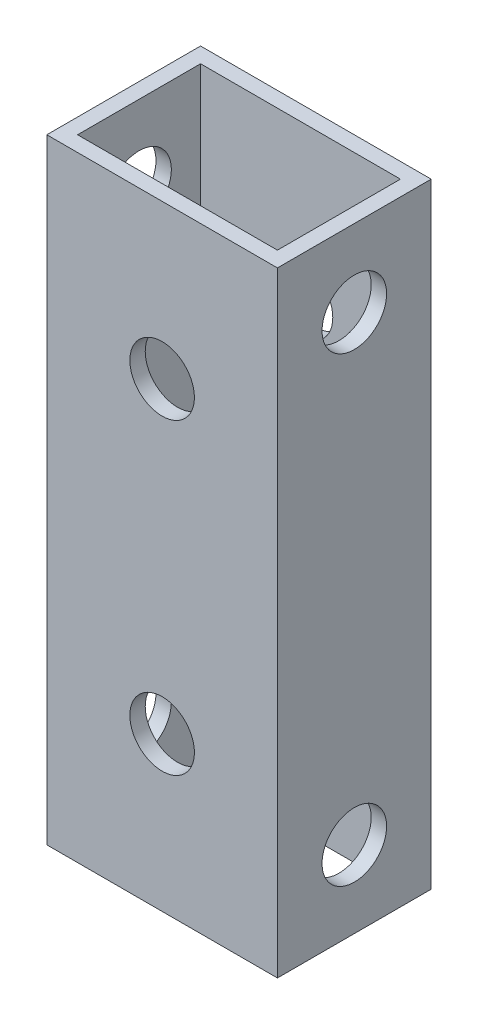
from build123d import *

# Parameters (mm, degrees)
SKETCH_1_W          = 15
SKETCH_1_H          = 10
SKETCH_1_W_2        = 13
SKETCH_1_H_2        = 8
EXTRUDE_1_DEPTH     = 40
SKETCH_2_R          = 2.1
CUT_EXTRUDE_1_DEPTH = 44.011626335
SKETCH_3_R          = 2.1
CUT_EXTRUDE_2_DEPTH = 42.907636536


with BuildPart() as part:
    # ｽｹｯﾁ1 → 押し出し-薄板1 (new body)
    with BuildSketch(Plane(origin=(0, 0, 0), x_dir=(1, 0, 0), z_dir=(0, 1, 0))):
        Rectangle(SKETCH_1_W, SKETCH_1_H)
        Rectangle(SKETCH_1_W_2, SKETCH_1_H_2, mode=Mode.SUBTRACT)
    extrude(amount=EXTRUDE_1_DEPTH)

    # ｽｹｯﾁ2 → ｶｯﾄ - 押し出し1 (cut, through all)
    with BuildSketch(Plane(origin=(7.5, 0, 0), x_dir=(0, 0, -1), z_dir=(1, 0, 0))):
        with Locations((0, 35)):
            Circle(SKETCH_2_R)
        with Locations((0, 5)):
            Circle(SKETCH_2_R)
    extrude(amount=-CUT_EXTRUDE_1_DEPTH, mode=Mode.SUBTRACT)

    # ｽｹｯﾁ3 → ｶｯﾄ - 押し出し2 (cut, through all)
    with BuildSketch(Plane.XY.offset(5)):
        with Locations((0, 30)):
            Circle(SKETCH_3_R)
        with Locations(Location((0, 10, 0), (0, 0, 180))):
            Circle(SKETCH_3_R)
    extrude(amount=-CUT_EXTRUDE_2_DEPTH, mode=Mode.SUBTRACT)


solid = part.part
